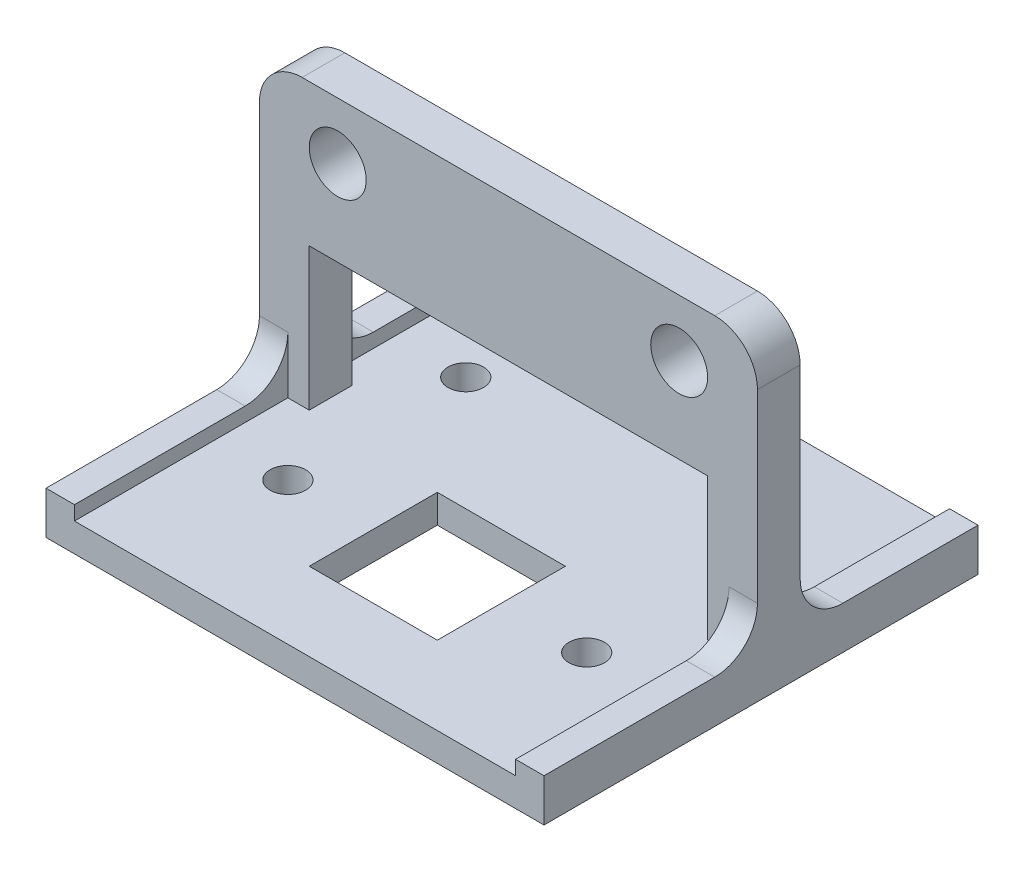
from build123d import *

# Parameters (mm, degrees)
SKETCH9_W           = 35
SKETCH9_H           = 30.5
SKETCH9_W_2         = 9
SKETCH9_H_2         = 9
BOSS_EXTRUDE5_DEPTH = 2
BOSS_EXTRUDE6_DEPTH = 1
CUT_EXTRUDE4_REACH  = 44.474
SKETCH12_R          = 1.25
SKETCH16_W          = 35
SKETCH16_H          = 22
SKETCH16_R          = 2
SKETCH16_W_2        = 28
SKETCH16_H_2        = 10
BOSS_EXTRUDE9_DEPTH = 3
SKETCH17_W          = 31
SKETCH17_H          = 1
CUT_EXTRUDE8_DEPTH  = 47.864165415
FILLET3_R           = 3


with BuildPart() as part:
    # Sketch9 → Boss-Extrude5 (new body)
    with BuildSketch(Plane(origin=(0, 0, 0), x_dir=(1, 0, 0), z_dir=(0, 1, 0))):
        with Locations((12.5, 14.75)):
            Rectangle(SKETCH9_W, SKETCH9_H)
        with Locations((12.5, 9.5)):
            Rectangle(SKETCH9_W_2, SKETCH9_H_2, mode=Mode.SUBTRACT)
    extrude(amount=BOSS_EXTRUDE5_DEPTH)

    # Sketch10 → Boss-Extrude6 (add)
    with BuildSketch(Plane(origin=(0, 2, 0), x_dir=(1, 0, 0), z_dir=(0, 1, 0))):
        Polygon((28, -0.5), (28, 28), (-3, 28), (-3, -0.5), (-5, -0.5), (-5, 30), (30, 30), (30, -0.5), align=None)
    extrude(amount=BOSS_EXTRUDE6_DEPTH)

    # Sketch12 → Cut-Extrude4 (cut, up to next)
    with BuildSketch(Plane(origin=(0, 2, 0), x_dir=(1, 0, 0), z_dir=(0, 1, 0)), mode=Mode.PRIVATE) as cut_extrude4_sk1:
        with Locations(Location((2, 22, 0), (0, 0, 270))):
            Circle(SKETCH12_R)
    cut_extrude4_tool1 = extrude(cut_extrude4_sk1.sketch, amount=-CUT_EXTRUDE4_REACH, mode=Mode.PRIVATE) & part.part
    # Sketch12 → Cut-Extrude4 (cut, up to next)
    with BuildSketch(Plane(origin=(0, 2, 0), x_dir=(1, 0, 0), z_dir=(0, 1, 0)), mode=Mode.PRIVATE) as cut_extrude4_sk2:
        with Locations(Location((2, 9.5, 0), (0, 0, 270))):
            Circle(SKETCH12_R)
    cut_extrude4_tool2 = extrude(cut_extrude4_sk2.sketch, amount=-CUT_EXTRUDE4_REACH, mode=Mode.PRIVATE) & part.part
    # Sketch12 → Cut-Extrude4 (cut, up to next)
    with BuildSketch(Plane(origin=(0, 2, 0), x_dir=(1, 0, 0), z_dir=(0, 1, 0)), mode=Mode.PRIVATE) as cut_extrude4_sk3:
        with Locations(Location((23, 9.5, 0), (0, 0, 270))):
            Circle(SKETCH12_R)
    cut_extrude4_tool3 = extrude(cut_extrude4_sk3.sketch, amount=-CUT_EXTRUDE4_REACH, mode=Mode.PRIVATE) & part.part
    # Sketch12 → Cut-Extrude4 (cut, up to next)
    with BuildSketch(Plane(origin=(0, 2, 0), x_dir=(1, 0, 0), z_dir=(0, 1, 0)), mode=Mode.PRIVATE) as cut_extrude4_sk4:
        with Locations(Location((23, 22, 0), (0, 0, 270))):
            Circle(SKETCH12_R)
    cut_extrude4_tool4 = extrude(cut_extrude4_sk4.sketch, amount=-CUT_EXTRUDE4_REACH, mode=Mode.PRIVATE) & part.part
    add(cut_extrude4_tool1.solids().sort_by_distance((2, 2, -22))[0], mode=Mode.SUBTRACT)
    add(cut_extrude4_tool2.solids().sort_by_distance((2, 2, -9.5))[0], mode=Mode.SUBTRACT)
    add(cut_extrude4_tool3.solids().sort_by_distance((23, 2, -9.5))[0], mode=Mode.SUBTRACT)
    add(cut_extrude4_tool4.solids().sort_by_distance((23, 2, -22))[0], mode=Mode.SUBTRACT)

    # Sketch16 → Boss-Extrude9 (add)
    with BuildSketch(Plane.XY.offset(-17.5)):
        with Locations((12.5, 11)):
            Rectangle(SKETCH16_W, SKETCH16_H)
        with Locations((0.5, 18)):
            Circle(SKETCH16_R, mode=Mode.SUBTRACT)
        with Locations(Location((24.5, 18, 0), (0, 0, 180))):
            Circle(SKETCH16_R, mode=Mode.SUBTRACT)
        with Locations((12.5, 7)):
            Rectangle(SKETCH16_W_2, SKETCH16_H_2, mode=Mode.SUBTRACT)
    extrude(amount=BOSS_EXTRUDE9_DEPTH)

    # Sketch17 → Cut-Extrude8 (cut, through all)
    with BuildSketch(Plane.XY.offset(-28)):
        with Locations((12.5, 2.5)):
            Rectangle(SKETCH17_W, SKETCH17_H)
    extrude(amount=-CUT_EXTRUDE8_DEPTH, mode=Mode.SUBTRACT)

    # Fillet3
    fillet3_edges = [part.edges().sort_by_distance(p)[0] for p in [
        (-4, 3, -17.5),
        (29, 3, -17.5),
        (-4, 3, -14.5),
        (29, 3, -14.5),
        (-5, 22, -16),
        (30, 22, -16),
    ]]
    fillet(fillet3_edges, radius=FILLET3_R)


solid = part.part
